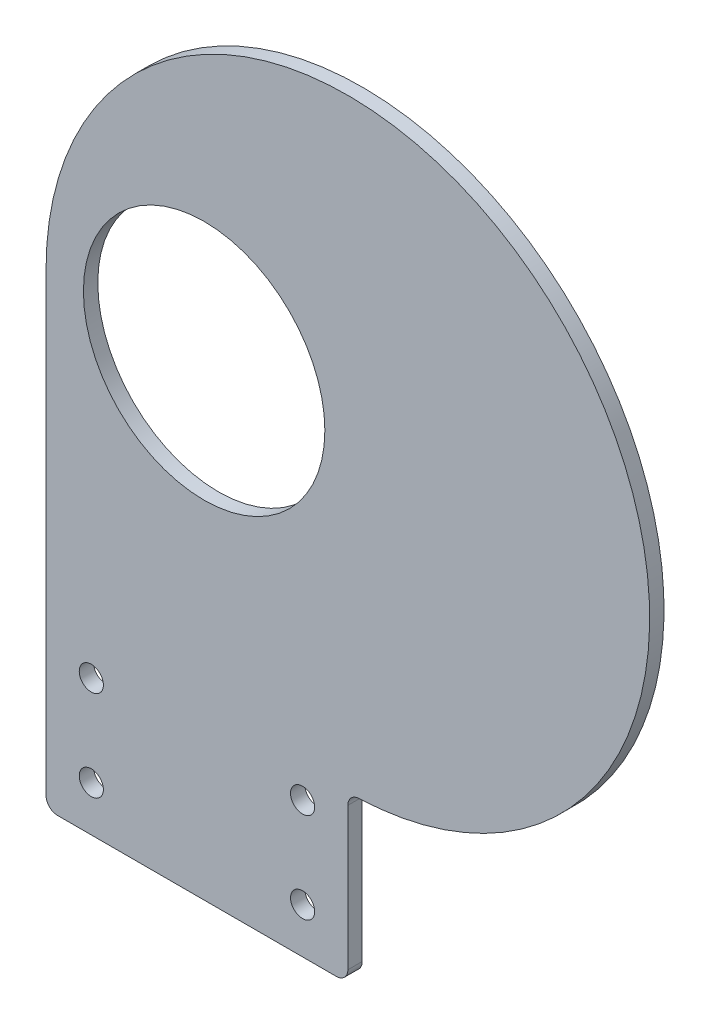
from build123d import *

# Parameters (mm, degrees)
SKETCH1_R           = 26.67
BOSS_EXTRUDE1_DEPTH = 3.175
CUT_EXTRUDE1_REACH  = 144.628
CUT_EXTRUDE2_REACH  = 144.628
SKETCH3_R           = 2.665
FILLET1_R           = 2.54


with BuildPart() as part:
    # Sketch1 → Boss-Extrude1 (new body)
    with BuildSketch(Plane.XY):
        with BuildLine():
            Line((-34.925, 0), (-34.925, -63.5))
            Line((-34.925, -63.5), (-34.925, -103.175))
            Line((-34.925, -103.175), (98.425, -103.175))
            Line((98.425, -103.175), (98.425, -64.833888838))
            Line((98.425, -64.833888838), (98.425, 0))
            ThreePointArc((98.425, 0), (31.75, 66.675), (-34.925, 0))
        make_face()
        Circle(SKETCH1_R, mode=Mode.SUBTRACT)
    extrude(amount=BOSS_EXTRUDE1_DEPTH)

    # Sketch2 → Cut-Extrude1 (cut, up to next)
    with BuildSketch(Plane.XY.offset(3.175), mode=Mode.PRIVATE) as cut_extrude1_sk1:
        with BuildLine():
            Line((31.75, -66.675), (31.75, -103.175))
            Line((31.75, -103.175), (98.425, -103.175))
            Line((98.425, -103.175), (98.425, 0))
            ThreePointArc((98.425, 0), (78.896344636, -47.146344636), (31.75, -66.675))
        make_face()
    cut_extrude1_tool1 = extrude(cut_extrude1_sk1.sketch, amount=-CUT_EXTRUDE1_REACH, mode=Mode.PRIVATE) & part.part
    add(cut_extrude1_tool1.solids().sort_by_distance((70.281775, -75.59134, 3.175))[0], mode=Mode.SUBTRACT)

    # Sketch3 → Cut-Extrude2 (cut, up to next)
    with BuildSketch(Plane(origin=(0, 0, 0), x_dir=(-1, 0, 0), z_dir=(0, 0, -1)), mode=Mode.PRIVATE) as cut_extrude2_sk1:
        with Locations((-21.75, -93.175)):
            Circle(SKETCH3_R)
    cut_extrude2_tool1 = extrude(cut_extrude2_sk1.sketch, amount=-CUT_EXTRUDE2_REACH, mode=Mode.PRIVATE) & part.part
    # Sketch3 → Cut-Extrude2 (cut, up to next)
    with BuildSketch(Plane(origin=(0, 0, 0), x_dir=(-1, 0, 0), z_dir=(0, 0, -1)), mode=Mode.PRIVATE) as cut_extrude2_sk2:
        with Locations(Location((-21.75, -73.175, 0), (0, 0, 180))):
            Circle(SKETCH3_R)
    cut_extrude2_tool2 = extrude(cut_extrude2_sk2.sketch, amount=-CUT_EXTRUDE2_REACH, mode=Mode.PRIVATE) & part.part
    # Sketch3 → Cut-Extrude2 (cut, up to next)
    with BuildSketch(Plane(origin=(0, 0, 0), x_dir=(-1, 0, 0), z_dir=(0, 0, -1)), mode=Mode.PRIVATE) as cut_extrude2_sk3:
        with Locations(Location((24.925, -93.175, 0), (0, 0, 180))):
            Circle(SKETCH3_R)
    cut_extrude2_tool3 = extrude(cut_extrude2_sk3.sketch, amount=-CUT_EXTRUDE2_REACH, mode=Mode.PRIVATE) & part.part
    # Sketch3 → Cut-Extrude2 (cut, up to next)
    with BuildSketch(Plane(origin=(0, 0, 0), x_dir=(-1, 0, 0), z_dir=(0, 0, -1)), mode=Mode.PRIVATE) as cut_extrude2_sk4:
        with Locations((24.925, -73.175)):
            Circle(SKETCH3_R)
    cut_extrude2_tool4 = extrude(cut_extrude2_sk4.sketch, amount=-CUT_EXTRUDE2_REACH, mode=Mode.PRIVATE) & part.part
    add(cut_extrude2_tool1.solids().sort_by_distance((21.75, -93.175, 0))[0], mode=Mode.SUBTRACT)
    add(cut_extrude2_tool2.solids().sort_by_distance((21.75, -73.175, 0))[0], mode=Mode.SUBTRACT)
    add(cut_extrude2_tool3.solids().sort_by_distance((-24.925, -93.175, 0))[0], mode=Mode.SUBTRACT)
    add(cut_extrude2_tool4.solids().sort_by_distance((-24.925, -73.175, 0))[0], mode=Mode.SUBTRACT)

    # Fillet1
    fillet1_edges = [part.edges().sort_by_distance(p)[0] for p in [
        (-34.925, -103.175, 1.5875),
        (31.75, -66.675, 1.5875),
        (31.75, -103.175, 1.5875),
    ]]
    fillet(fillet1_edges, radius=FILLET1_R)


solid = part.part
